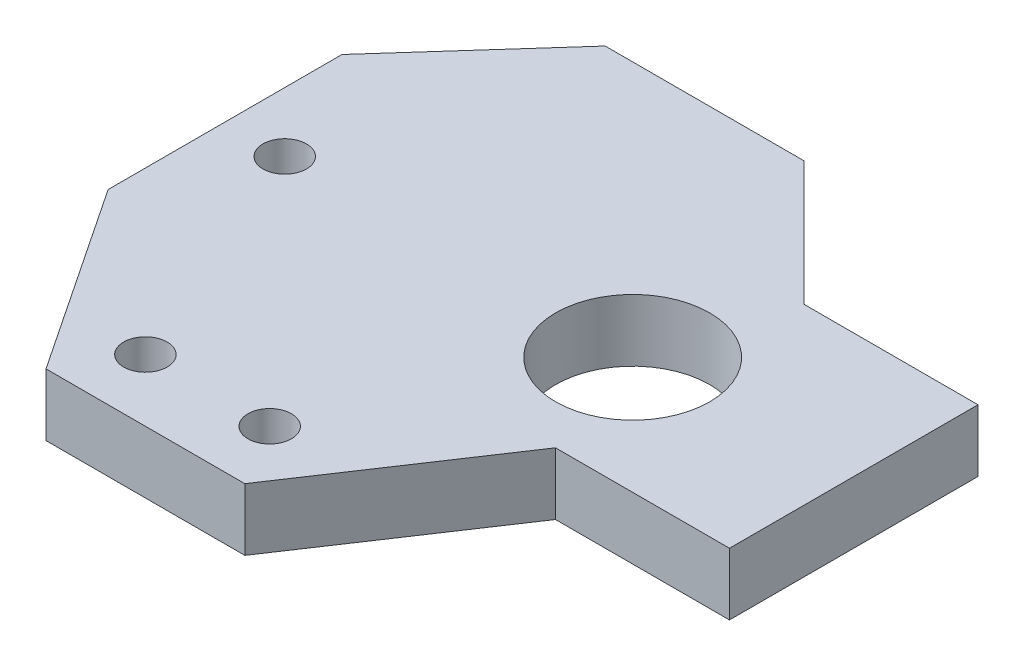
from build123d import *

# Parameters (mm, degrees)
SKETCH1_R           = 1.75
BOSS_EXTRUDE1_DEPTH = 5
SKETCH2_R           = 1.75
SKETCH2_R_2         = 6.2
CUT_EXTRUDE1_DEPTH  = 10


with BuildPart() as part:
    # Sketch1 → Boss-Extrude1 (new body)
    # profile 1 of 4: a face of its own
    with BuildSketch(Plane(origin=(0, 0, 0), x_dir=(1, 0, 0), z_dir=(0, 1, 0))):
        Polygon((50, 25), (0, 25), (0, 15), (10, 0), (26, 0), (36, 15), (50, 15), align=None)
        with Locations(Location((13, 5, 0), (0, 0, 270))):
            Circle(SKETCH1_R, mode=Mode.SUBTRACT)
        with Locations(Location((23, 5, 0), (0, 0, 270))):
            Circle(SKETCH1_R, mode=Mode.SUBTRACT)
    # profile 2 of 4: a face of its own
    with BuildSketch(Plane(origin=(0, 0, 0), x_dir=(1, 0, 0), z_dir=(0, 1, 0))):
        Polygon((10, 45), (0, 33.819660113), (0, 25), (50, 25), (50, 35), (36, 35), (26, 45), align=None)
    # profile 3 of 4: a face of its own
    with BuildSketch(Plane(origin=(0, 0, 0), x_dir=(1, 0, 0), z_dir=(0, 1, 0))):
        Polygon((10, 45), (0, 33.819660113), (0, 25), (50, 25), (50, 35), (36, 35), (26, 45), align=None)
    # profile 4 of 4: a face of its own
    with BuildSketch(Plane(origin=(0, 0, 0), x_dir=(1, 0, 0), z_dir=(0, 1, 0))):
        Polygon((10, 45), (0, 33.819660113), (0, 25), (50, 25), (50, 35), (36, 35), (26, 45), align=None)
    extrude(amount=BOSS_EXTRUDE1_DEPTH)

    # Sketch2 → Cut-Extrude1 (cut)
    with BuildSketch(Plane(origin=(0, 0, 0), x_dir=(-1, 0, 0), z_dir=(0, -1, 0))):
        with Locations(Location((-4.8, 24.409830056, 0), (0, 0, 90))):
            Circle(SKETCH2_R)
        with Locations(Location((-32.8, 24.409830056, 0), (0, 0, 90))):
            Circle(SKETCH2_R_2)
    extrude(amount=-CUT_EXTRUDE1_DEPTH, mode=Mode.SUBTRACT)


solid = part.part
